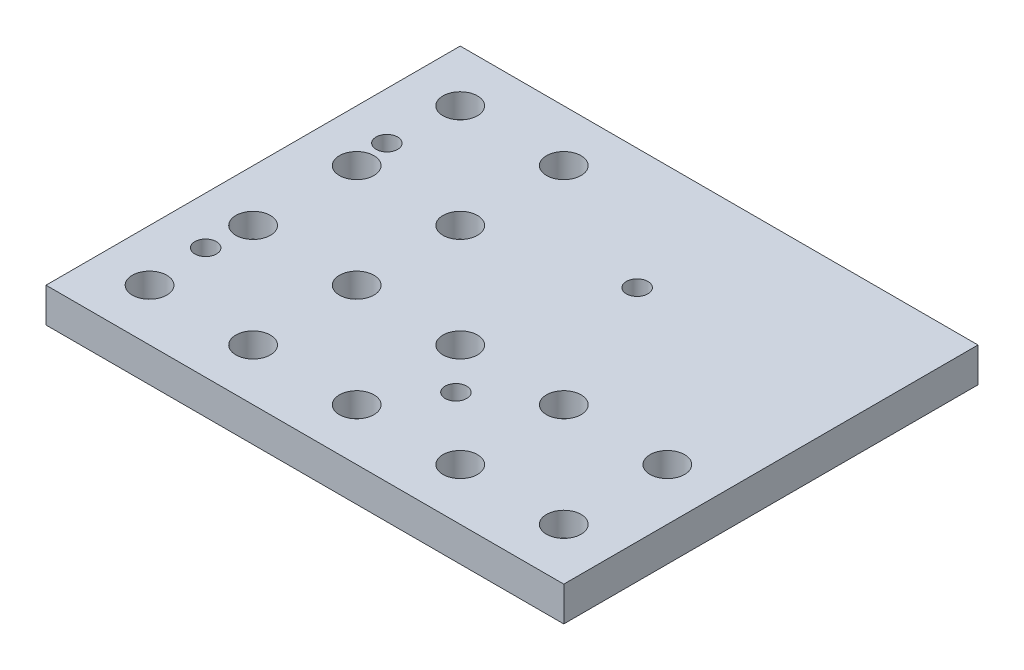
from build123d import *

# Parameters (mm, degrees)
SKETCH1_W                                            = 190.5
SKETCH1_H                                            = 152.4
BOSS_EXTRUDE1_DEPTH                                  = 12.7
CBORE_FOR_1_4_BINDING_HEAD_MACHINE_SCREW_D           = 8.3312
CBORE_FOR_1_4_BINDING_HEAD_MACHINE_SCREW_CBORE_D     = 12.7
CBORE_FOR_1_4_BINDING_HEAD_MACHINE_SCREW_CBORE_DEPTH = 8.89
CBORE_FOR_1_4_BINDING_HEAD_MACHINE_S_2_D             = 8.3312
CBORE_FOR_1_4_BINDING_HEAD_MACHINE_S_2_CBORE_D       = 12.7
CBORE_FOR_1_4_BINDING_HEAD_MACHINE_S_2_CBORE_DEPTH   = 8.89
F_3_8_16_TAPPED_HOLE1_D                              = 7.9375
LPATTERN1_COUNT                                      = 2
LPATTERN1_PITCH                                      = 92.075
LPATTERN1_COUNT_DIR2                                 = 2
LPATTERN1_PITCH_DIR2                                 = 66.675


with BuildPart() as part:
    # Sketch1 → Boss-Extrude1 (new body)
    with BuildSketch(Plane(origin=(0, 0, 0), x_dir=(1, 0, 0), z_dir=(0, 1, 0))):
        with Locations((95.25, 76.2)):
            Rectangle(SKETCH1_W, SKETCH1_H)
    extrude(amount=BOSS_EXTRUDE1_DEPTH)

    # CBORE for 1_4 Binding Head Machine Screw (through all)
    with Locations(Plane(origin=(0, 12.7, 0), x_dir=(1, 0, 0), z_dir=(0, 1, 0))):
        with Locations((19.05, 19.05), (57.15, 19.05), (95.25, 19.05), (133.35, 19.05), (19.05, 57.15), (19.05, 95.25), (19.05, 133.35), (57.15, 57.15), (95.25, 57.15), (133.35, 57.15), (57.15, 95.25), (57.15, 133.35)):
            CounterBoreHole(CBORE_FOR_1_4_BINDING_HEAD_MACHINE_SCREW_D / 2, CBORE_FOR_1_4_BINDING_HEAD_MACHINE_SCREW_CBORE_D / 2, CBORE_FOR_1_4_BINDING_HEAD_MACHINE_SCREW_CBORE_DEPTH)

    # CBORE for 1_4 Binding Head Machine S 2 (through all)
    with Locations(Plane(origin=(0, 12.7, 0), x_dir=(1, 0, 0), z_dir=(0, 1, 0))):
        with Locations((171.45, 19.05), (171.45, 57.15)):
            CounterBoreHole(CBORE_FOR_1_4_BINDING_HEAD_MACHINE_S_2_D / 2, CBORE_FOR_1_4_BINDING_HEAD_MACHINE_S_2_CBORE_D / 2, CBORE_FOR_1_4_BINDING_HEAD_MACHINE_S_2_CBORE_DEPTH)

    # 3/8-16 Tapped Hole1 (through all)
    with Locations(Plane(origin=(0, 12.7, 0), x_dir=(1, 0, 0), z_dir=(0, 1, 0))):
        with Locations((17.4625, 41.275)):
            f_3_8_16_tapped_hole1 = Hole(F_3_8_16_TAPPED_HOLE1_D / 2)

    # LPattern1: 3_8-16 Tapped Hole1 2 × 2
    with Locations(*[(i * LPATTERN1_PITCH, 0, -j * LPATTERN1_PITCH_DIR2) for i in range(LPATTERN1_COUNT) for j in range(LPATTERN1_COUNT_DIR2) if (i, j) != (0, 0)]):
        add(f_3_8_16_tapped_hole1, mode=Mode.SUBTRACT)


solid = part.part
